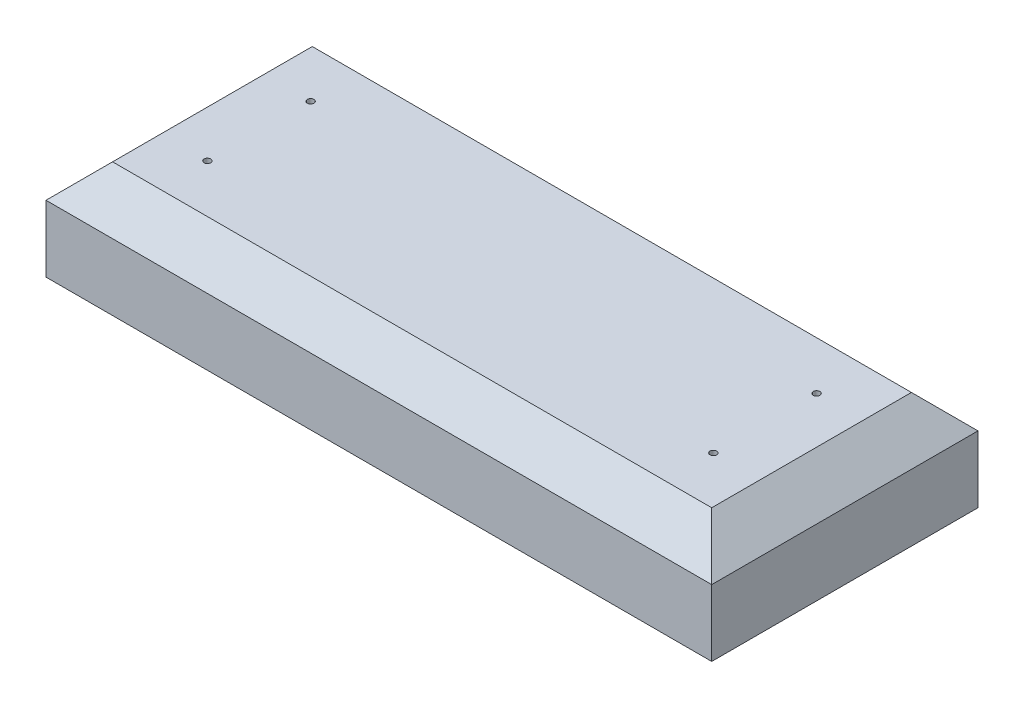
from build123d import *

# Parameters (mm, degrees)
SKETCH1_W            = 200
SKETCH1_H            = 80
BOSS_EXTRUDE1_DEPTH  = 30
CHAMFER1_SIZE        = 10
SKETCH2_R            = 1
CUT_EXTRUDE1_DEPTH   = 40
LPATTERN1_COUNT      = 3
LPATTERN1_PITCH      = 152
LPATTERN1_COUNT_DIR2 = 2
LPATTERN1_PITCH_DIR2 = 31


with BuildPart() as part:
    # Sketch1 → Boss-Extrude1 (new body)
    with BuildSketch(Plane(origin=(0, 0, 0), x_dir=(1, 0, 0), z_dir=(0, 1, 0))):
        with Locations((-74.550128535, 27.789203085)):
            Rectangle(SKETCH1_W, SKETCH1_H)
    extrude(amount=BOSS_EXTRUDE1_DEPTH)

    # Chamfer1
    chamfer1_edges = [part.edges().sort_by_distance(p)[0] for p in [
        (-174.550128535, 30, -27.789203085),
        (-74.550128535, 30, 12.210796915),
        (25.449871465, 30, -27.789203085),
        (-74.550128535, 30, -67.789203085),
    ]]
    chamfer(chamfer1_edges, length=CHAMFER1_SIZE)

    # Sketch2 → Cut-Extrude1 (cut)
    with BuildSketch(Plane(origin=(0, 30, 0), x_dir=(1, 0, 0), z_dir=(0, 1, 0))):
        with Locations(Location((1.449871465, 43.289203085, 0), (0, 0, 270))):
            Circle(SKETCH2_R)
    cut_extrude1 = extrude(amount=-CUT_EXTRUDE1_DEPTH, mode=Mode.SUBTRACT)

    # LPattern1: Cut-Extrude1 3 × 2
    with Locations(*[(-i * LPATTERN1_PITCH, 0, j * LPATTERN1_PITCH_DIR2) for i in range(LPATTERN1_COUNT) for j in range(LPATTERN1_COUNT_DIR2) if (i, j) != (0, 0)]):
        add(cut_extrude1, mode=Mode.SUBTRACT)


solid = part.part
